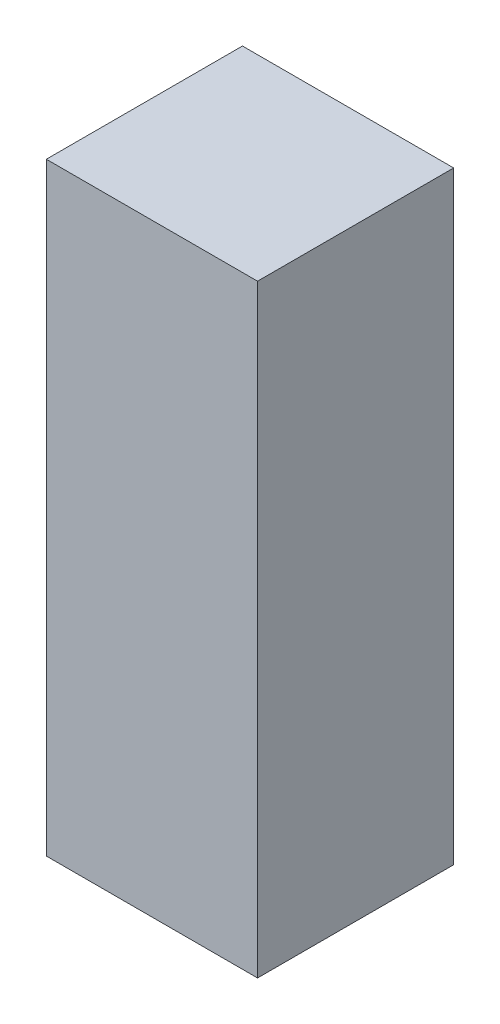
from build123d import *

# Parameters (mm, degrees)
OVEN_YAG_KABI_KAPAGI_MENTESE_2_1_START = 20
SKETCH1_W                              = 14
SKETCH1_H                              = 40
OVEN_YAG_KABI_KAPAGI_MENTESE_2_1_DEPTH = 13


with BuildPart() as part:
    # Sketch1 → OVEN_yag_kabi_kapagi_mentese_2_1 (new body)
    with BuildSketch(Plane.XY.offset(OVEN_YAG_KABI_KAPAGI_MENTESE_2_1_START)):
        with Locations((31, 1060)):
            Rectangle(SKETCH1_W, SKETCH1_H)
    extrude(amount=OVEN_YAG_KABI_KAPAGI_MENTESE_2_1_DEPTH)


solid = part.part
